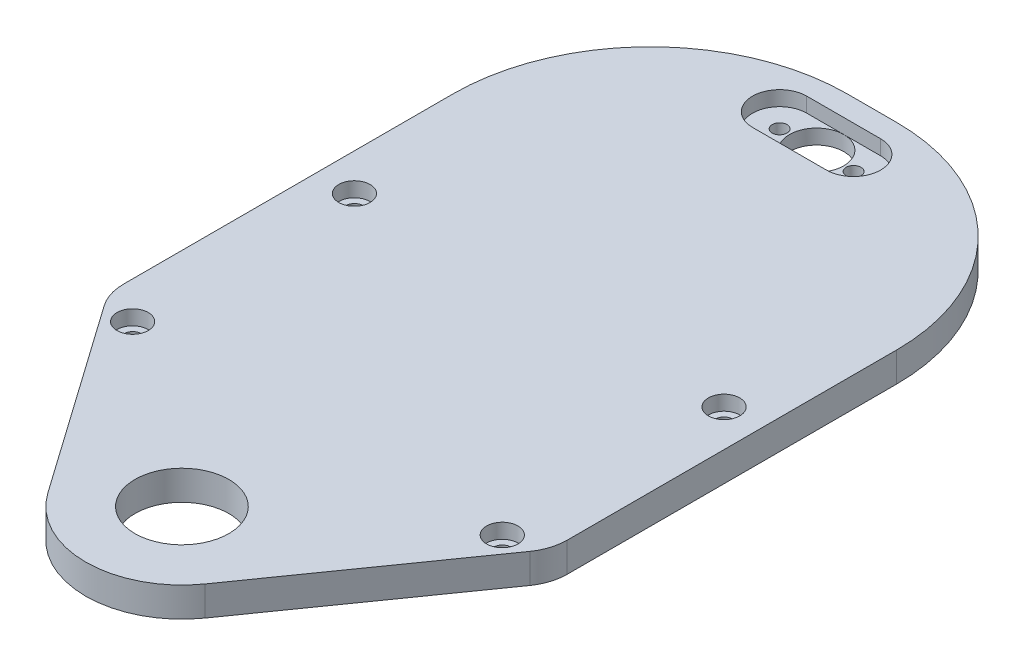
from build123d import *

# Parameters (mm, degrees)
SKETCH1_R          = 9.525
BODY_DEPTH         = 6
SKETCH2_R          = 1.5
SKETCH2_R_2        = 5.5
SKETCH2_R_3        = 1.75
HOLES_DEPTH        = 6
FILLET1_R          = 10
FILLET2_R          = 40
SKETCH3_R          = 3.175
CUT_EXTRUDE2_DEPTH = 3


with BuildPart() as part:
    # Sketch1 → Body (new body)
    with BuildSketch(Plane(origin=(0, 0, 0), x_dir=(1, 0, 0), z_dir=(0, 1, 0))):
        with BuildLine():
            Line((45, -55), (15.965110713, -96.240145236))
            ThreePointArc((15.965110713, -96.240145236), (0, -104.525), (-15.965110713, -96.240145236))
            Line((-15.965110713, -96.240145236), (-45, -55))
            Line((-45, -55), (-45, 55))
            Line((-45, 55), (45, 55))
            Line((45, 55), (45, -55))
        make_face()
        with Locations(Location((0, -85, 0), (0, 0, 270))):
            Circle(SKETCH1_R, mode=Mode.SUBTRACT)
    extrude(amount=BODY_DEPTH)

    # Sketch2 → Holes (cut)
    with BuildSketch(Plane(origin=(0, 6, 0), x_dir=(1, 0, 0), z_dir=(0, 1, 0))):
        with Locations(Location((6.273420837, 45, 0), (0, 0, 270))):
            Circle(SKETCH2_R)
        with Locations(Location((-8.726579163, 45, 0), (0, 0, 270))):
            Circle(SKETCH2_R)
        with Locations(Location((-1.226579163, 45, 0), (0, 0, 270))):
            Circle(SKETCH2_R_2)
        with Locations(Location((37.5, -57.5, 0), (0, 0, 270))):
            Circle(SKETCH2_R_3)
        with Locations(Location((-37.5, -57.5, 0), (0, 0, 270))):
            Circle(SKETCH2_R_3)
        with Locations(Location((-37.5, -12.5, 0), (0, 0, 270))):
            Circle(SKETCH2_R_3)
        with Locations(Location((37.5, -12.5, 0), (0, 0, 270))):
            Circle(SKETCH2_R_3)
    extrude(amount=-HOLES_DEPTH, mode=Mode.SUBTRACT)

    # Fillet1
    fillet1_edges = [part.edges().sort_by_distance(p)[0] for p in [
        (45, 3, 55),
        (-45, 3, 55),
    ]]
    fillet(fillet1_edges, radius=FILLET1_R)

    # Fillet2
    fillet2_edges = [part.edges().sort_by_distance(p)[0] for p in [
        (-45, 3, -55),
        (45, 3, -55),
    ]]
    fillet(fillet2_edges, radius=FILLET2_R)

    # Sketch3 → Cut-Extrude2 (cut)
    with BuildSketch(Plane(origin=(0, 6, 0), x_dir=(1, 0, 0), z_dir=(0, 1, 0))):
        with Locations(Location((-37.5, -12.5, 0), (0, 0, 270))):
            Circle(SKETCH3_R)
        with Locations(Location((37.5, -12.5, 0), (0, 0, 270))):
            Circle(SKETCH3_R)
        with Locations(Location((37.5, -57.5, 0), (0, 0, 270))):
            Circle(SKETCH3_R)
        with Locations(Location((-37.5, -57.5, 0), (0, 0, 270))):
            Circle(SKETCH3_R)
        with BuildLine():
            Line((-8.726579163, 50.5), (6.273420837, 50.5))
            ThreePointArc((6.273420837, 50.5), (11.773420837, 45), (6.273420837, 39.5))
            Line((6.273420837, 39.5), (-8.726579163, 39.5))
            ThreePointArc((-8.726579163, 39.5), (-14.226579163, 45), (-8.726579163, 50.5))
        make_face()
    extrude(amount=-CUT_EXTRUDE2_DEPTH, mode=Mode.SUBTRACT)


solid = part.part
